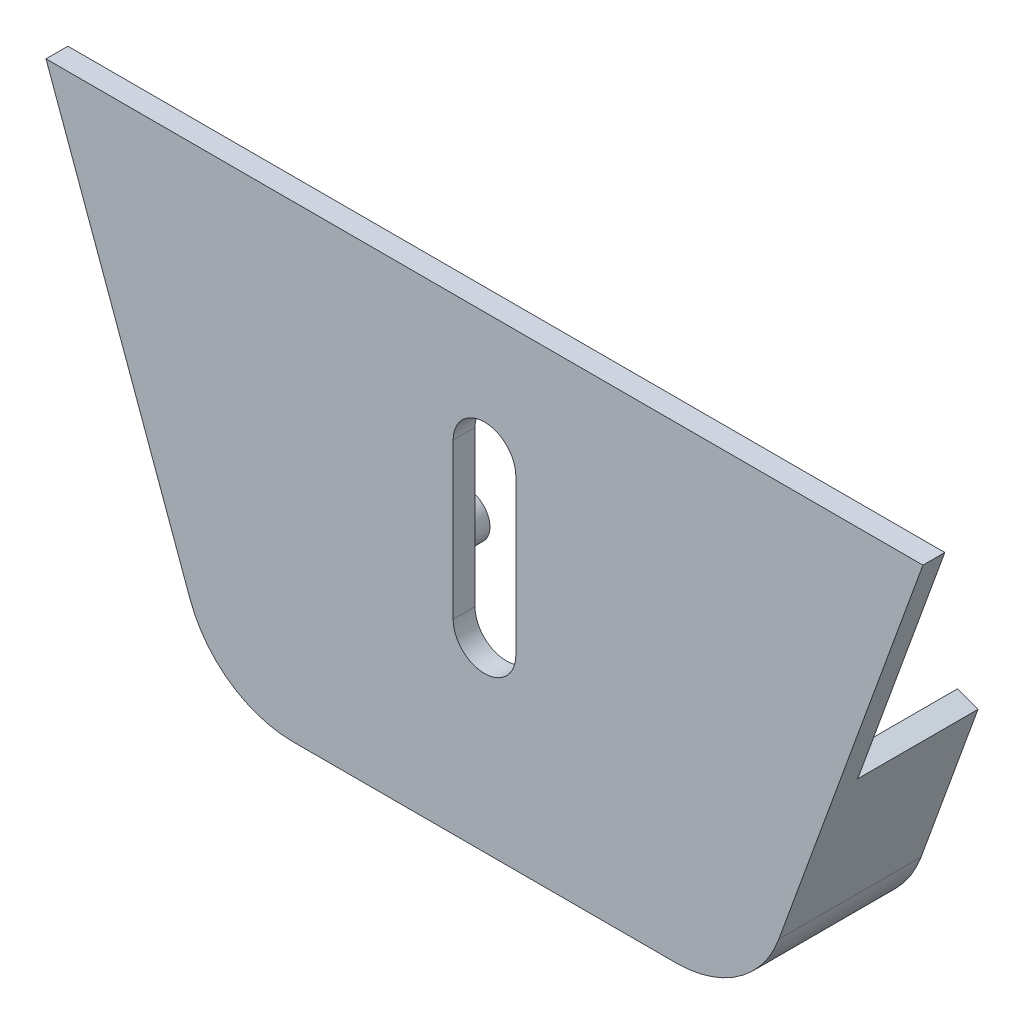
from build123d import *

# Parameters (mm, degrees)
SKETCH1_R           = 2
BOSS_EXTRUDE1_DEPTH = 2
BOSS_EXTRUDE2_START = -6
SKETCH2_R           = 3.5
SKETCH2_R_2         = 2
BOSS_EXTRUDE2_DEPTH = 4
BOSS_EXTRUDE3_START = 11
BOSS_EXTRUDE3_DEPTH = 11
BOSS_EXTRUDE4_START = -16
SKETCH5_R           = 2
BOSS_EXTRUDE4_DEPTH = 16


with BuildPart() as part:
    # Sketch1 → Boss-Extrude1 (new body)
    with BuildSketch(Plane.XY):
        with BuildLine():
            Line((-17.5, -10), (17.5, -10))
            ThreePointArc((17.5, -10), (23.235764364, -8.191520443), (26.896926208, -3.420201433))
            Line((26.896926208, -3.420201433), (40.065448474, 32.76001614))
            Line((40.065448474, 32.76001614), (-40.065448474, 32.76001614))
            Line((-40.065448474, 32.76001614), (-26.896926208, -3.420201433))
            ThreePointArc((-26.896926208, -3.420201433), (-23.235764364, -8.191520443), (-17.5, -10))
        make_face()
        with Locations((17.5, 0)):
            Circle(SKETCH1_R, mode=Mode.SUBTRACT)
        with Locations((-17.5, 0)):
            Circle(SKETCH1_R, mode=Mode.SUBTRACT)
        with BuildLine():
            Line((2.863480555, 21.190949642), (2.863480555, 7.014373782))
            ThreePointArc((2.863480555, 7.014373782), (0, 4.150893227), (-2.863480555, 7.014373782))
            Line((-2.863480555, 7.014373782), (-2.863480555, 21.190949642))
            ThreePointArc((-2.863480555, 21.190949642), (0, 24.054430197), (2.863480555, 21.190949642))
        make_face(mode=Mode.SUBTRACT)
    extrude(amount=BOSS_EXTRUDE1_DEPTH)

    # Sketch2 → Boss-Extrude2 (add)
    # profile 1 of 2: a face of its own
    with BuildSketch(Plane.XY.offset(2).offset(BOSS_EXTRUDE2_START)):
        with Locations((-17.5, 0)):
            Circle(SKETCH2_R)
        with Locations((-17.5, 0)):
            Circle(SKETCH2_R_2, mode=Mode.SUBTRACT)
    # profile 2 of 2: a face of its own
    with BuildSketch(Plane.XY.offset(2).offset(BOSS_EXTRUDE2_START)):
        with Locations((17.5, 0)):
            Circle(SKETCH2_R)
        with Locations((17.5, 0)):
            Circle(SKETCH2_R_2, mode=Mode.SUBTRACT)
    extrude(amount=BOSS_EXTRUDE2_DEPTH)

    # Sketch4 → Boss-Extrude3 (add)
    with BuildSketch(Plane(origin=(0, 0, 0), x_dir=(-1, 0, 0), z_dir=(0, 0, -1)).offset(BOSS_EXTRUDE3_START)):
        with BuildLine():
            Line((-26.896926208, -3.420201433), (-32.095820312, 10.863642724))
            Line((-32.095820312, 10.863642724), (-30.21643507, 11.547683011))
            Line((-30.21643507, 11.547683011), (-25.017540966, -2.736161147))
            ThreePointArc((-25.017540966, -2.736161147), (-22.088611491, -6.553216354), (-17.5, -8))
            Line((-17.5, -8), (-17.5, -10))
            ThreePointArc((-17.5, -10), (-23.235764364, -8.191520443), (-26.896926208, -3.420201433))
        make_face()
        with BuildLine():
            Line((32.095820312, 10.863642724), (26.896926208, -3.420201433))
            ThreePointArc((26.896926208, -3.420201433), (23.235764364, -8.191520443), (17.5, -10))
            Line((17.5, -10), (17.5, -8))
            ThreePointArc((17.5, -8), (22.088611491, -6.553216354), (25.017540966, -2.736161147))
            Line((25.017540966, -2.736161147), (30.21643507, 11.547683011))
            Line((30.21643507, 11.547683011), (32.095820312, 10.863642724))
        make_face()
    extrude(amount=-BOSS_EXTRUDE3_DEPTH)

    # Sketch5 → Boss-Extrude4 (add)
    with BuildSketch(Plane.XY.offset(2).offset(BOSS_EXTRUDE4_START)):
        with Locations((-17.5, 0)):
            Circle(SKETCH5_R)
        with Locations((17.5, 0)):
            Circle(SKETCH5_R)
    extrude(amount=BOSS_EXTRUDE4_DEPTH)


solid = part.part
